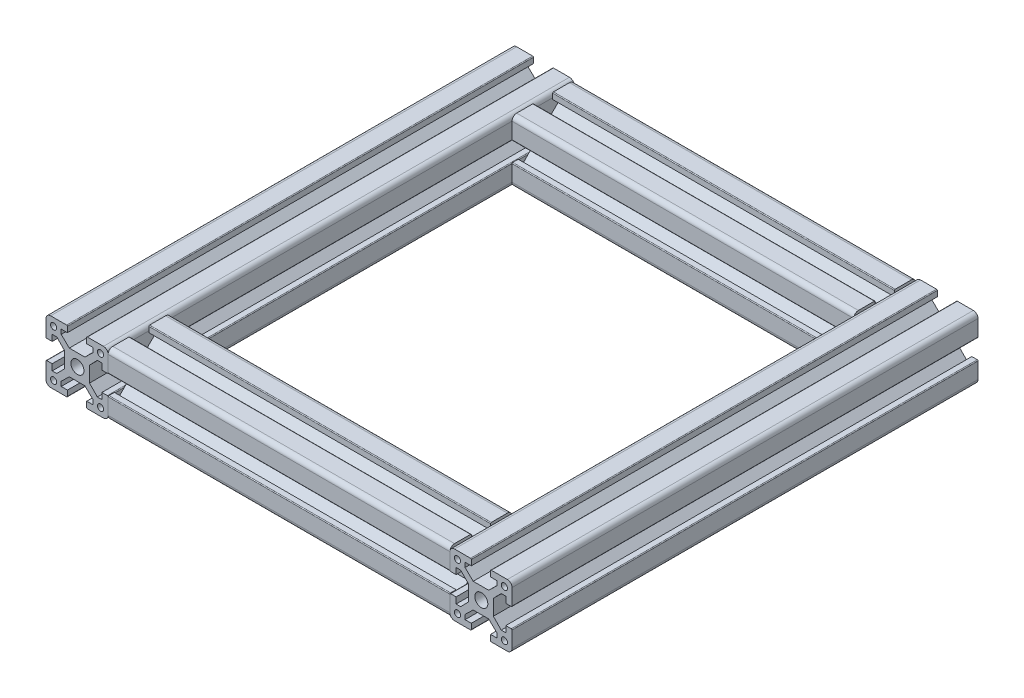
from build123d import *

# Parameters (mm, degrees)
XA_XA_2020T_1_DEPTH      = 140.110875788
XA_XA_2020T_1_DEPTH_BACK = 9.889124212
SKETCH1_R                = 1
SKETCH1_R_2              = 2.1
SKETCH1_ON_SEGMENT_2_R   = 1
SKETCH1_ON_SEGMENT_2_R_2 = 2.1
XA_XA_2020T_1_2_DEPTH    = 150
SKETCH1_ON_SEGMENT_3_R   = 1
SKETCH1_ON_SEGMENT_3_R_2 = 2.1
XA_XA_2020T_1_3_DEPTH    = 132
SKETCH1_ON_SEGMENT_4_R   = 1
SKETCH1_ON_SEGMENT_4_R_2 = 2.1
XA_XA_2020T_1_4_DEPTH    = 132


with BuildPart() as part:
    # Sketch1 → Xa XA-2020T(1) (new, two sides: drawn at the far end of the back side and taken through both)
    with BuildSketch(Plane(origin=(-65, 0, 65), x_dir=(-1, 0, 0), z_dir=(0, 0, -1)).offset(-XA_XA_2020T_1_DEPTH_BACK)):
        with BuildLine():
            Line((-9.889124212, 8.439448346), (-9.889124212, 3.289448346))
            ThreePointArc((-9.889124212, 3.289448346), (-9.815900907, 3.112671651), (-9.639124212, 3.039448346))
            Line((-9.639124212, 3.039448346), (-7.889124212, 3.039448346))
            Line((-7.889124212, 3.039448346), (-7.889124212, 5.039448346))
            Line((-7.889124212, 5.039448346), (-6.41690199, 5.039448346))
            Line((-6.41690199, 5.039448346), (-3.889124212, 2.439448346))
            Line((-3.889124212, 2.439448346), (-3.889124212, -2.560551654))
            Line((-3.889124212, -2.560551654), (-6.41690199, -5.160551654))
            Line((-6.41690199, -5.160551654), (-7.889124212, -5.160551654))
            Line((-7.889124212, -5.160551654), (-7.889124212, -3.160551654))
            Line((-7.889124212, -3.160551654), (-9.639124212, -3.160551654))
            ThreePointArc((-9.639124212, -3.160551654), (-9.815900907, -3.233774958), (-9.889124212, -3.410551654))
            Line((-9.889124212, -3.410551654), (-9.889124212, -8.560551654))
            ThreePointArc((-9.889124212, -8.560551654), (-9.449784384, -9.621211825), (-8.389124212, -10.060551654))
            Line((-8.389124212, -10.060551654), (-3.239124212, -10.060551654))
            ThreePointArc((-3.239124212, -10.060551654), (-3.062347516, -9.987328349), (-2.989124212, -9.810551654))
            Line((-2.989124212, -9.810551654), (-2.989124212, -8.060551654))
            Line((-2.989124212, -8.060551654), (-4.989124212, -8.060551654))
            Line((-4.989124212, -8.060551654), (-4.989124212, -6.588329431))
            Line((-4.989124212, -6.588329431), (-2.389124212, -4.060551654))
            Line((-2.389124212, -4.060551654), (2.610875788, -4.060551654))
            Line((2.610875788, -4.060551654), (5.210875788, -6.588329431))
            Line((5.210875788, -6.588329431), (5.210875788, -8.060551654))
            Line((5.210875788, -8.060551654), (3.210875788, -8.060551654))
            Line((3.210875788, -8.060551654), (3.210875788, -9.810551654))
            ThreePointArc((3.210875788, -9.810551654), (3.284099093, -9.987328349), (3.460875788, -10.060551654))
            Line((3.460875788, -10.060551654), (8.610875788, -10.060551654))
            ThreePointArc((8.610875788, -10.060551654), (9.67153596, -9.621211825), (10.110875788, -8.560551654))
            Line((10.110875788, -8.560551654), (10.110875788, -3.410551654))
            ThreePointArc((10.110875788, -3.410551654), (10.037652484, -3.233774958), (9.860875788, -3.160551654))
            Line((9.860875788, -3.160551654), (8.110875788, -3.160551654))
            Line((8.110875788, -3.160551654), (8.110875788, -5.160551654))
            Line((8.110875788, -5.160551654), (6.638653566, -5.160551654))
            Line((6.638653566, -5.160551654), (4.110875788, -2.560551654))
            Line((4.110875788, -2.560551654), (4.110875788, 2.439448346))
            Line((4.110875788, 2.439448346), (6.638653566, 5.039448346))
            Line((6.638653566, 5.039448346), (8.110875788, 5.039448346))
            Line((8.110875788, 5.039448346), (8.110875788, 3.039448346))
            Line((8.110875788, 3.039448346), (9.860875788, 3.039448346))
            ThreePointArc((9.860875788, 3.039448346), (10.037652484, 3.112671651), (10.110875788, 3.289448346))
            Line((10.110875788, 3.289448346), (10.110875788, 8.439448346))
            ThreePointArc((10.110875788, 8.439448346), (9.67153596, 9.500108518), (8.610875788, 9.939448346))
            Line((8.610875788, 9.939448346), (3.460875788, 9.939448346))
            ThreePointArc((3.460875788, 9.939448346), (3.284099093, 9.866225042), (3.210875788, 9.689448346))
            Line((3.210875788, 9.689448346), (3.210875788, 7.939448346))
            Line((3.210875788, 7.939448346), (5.210875788, 7.939448346))
            Line((5.210875788, 7.939448346), (5.210875788, 6.467226124))
            Line((5.210875788, 6.467226124), (2.610875788, 3.939448346))
            Line((2.610875788, 3.939448346), (-2.389124212, 3.939448346))
            Line((-2.389124212, 3.939448346), (-4.989124212, 6.467226124))
            Line((-4.989124212, 6.467226124), (-4.989124212, 7.939448346))
            Line((-4.989124212, 7.939448346), (-2.989124212, 7.939448346))
            Line((-2.989124212, 7.939448346), (-2.989124212, 9.689448346))
            ThreePointArc((-2.989124212, 9.689448346), (-3.062347516, 9.866225042), (-3.239124212, 9.939448346))
            Line((-3.239124212, 9.939448346), (-8.389124212, 9.939448346))
            ThreePointArc((-8.389124212, 9.939448346), (-9.449784384, 9.500108518), (-9.889124212, 8.439448346))
        make_face()
        with Locations((-7.439124212, 7.489448346)):
            Circle(SKETCH1_R, mode=Mode.SUBTRACT)
        with Locations((7.660875788, 7.489448346)):
            Circle(SKETCH1_R, mode=Mode.SUBTRACT)
        with Locations((-7.439124212, -7.610551654)):
            Circle(SKETCH1_R, mode=Mode.SUBTRACT)
        with Locations((7.660875788, -7.610551654)):
            Circle(SKETCH1_R, mode=Mode.SUBTRACT)
        Circle(SKETCH1_R_2, mode=Mode.SUBTRACT)
    extrude(amount=XA_XA_2020T_1_DEPTH + XA_XA_2020T_1_DEPTH_BACK)


with BuildPart() as body_2:
    # Sketch1 on segment 2 (carried to segment 2) → Xa XA-2020T_1 2 (new body)
    with BuildSketch(Plane(origin=(65, 0, 74.889124212), x_dir=(-1, 0, 0), z_dir=(0, 0, -1))):
        with BuildLine():
            Line((-9.889124212, 8.439448346), (-9.889124212, 3.289448346))
            ThreePointArc((-9.889124212, 3.289448346), (-9.815900907, 3.112671651), (-9.639124212, 3.039448346))
            Line((-9.639124212, 3.039448346), (-7.889124212, 3.039448346))
            Line((-7.889124212, 3.039448346), (-7.889124212, 5.039448346))
            Line((-7.889124212, 5.039448346), (-6.41690199, 5.039448346))
            Line((-6.41690199, 5.039448346), (-3.889124212, 2.439448346))
            Line((-3.889124212, 2.439448346), (-3.889124212, -2.560551654))
            Line((-3.889124212, -2.560551654), (-6.41690199, -5.160551654))
            Line((-6.41690199, -5.160551654), (-7.889124212, -5.160551654))
            Line((-7.889124212, -5.160551654), (-7.889124212, -3.160551654))
            Line((-7.889124212, -3.160551654), (-9.639124212, -3.160551654))
            ThreePointArc((-9.639124212, -3.160551654), (-9.815900907, -3.233774958), (-9.889124212, -3.410551654))
            Line((-9.889124212, -3.410551654), (-9.889124212, -8.560551654))
            ThreePointArc((-9.889124212, -8.560551654), (-9.449784384, -9.621211825), (-8.389124212, -10.060551654))
            Line((-8.389124212, -10.060551654), (-3.239124212, -10.060551654))
            ThreePointArc((-3.239124212, -10.060551654), (-3.062347516, -9.987328349), (-2.989124212, -9.810551654))
            Line((-2.989124212, -9.810551654), (-2.989124212, -8.060551654))
            Line((-2.989124212, -8.060551654), (-4.989124212, -8.060551654))
            Line((-4.989124212, -8.060551654), (-4.989124212, -6.588329431))
            Line((-4.989124212, -6.588329431), (-2.389124212, -4.060551654))
            Line((-2.389124212, -4.060551654), (2.610875788, -4.060551654))
            Line((2.610875788, -4.060551654), (5.210875788, -6.588329431))
            Line((5.210875788, -6.588329431), (5.210875788, -8.060551654))
            Line((5.210875788, -8.060551654), (3.210875788, -8.060551654))
            Line((3.210875788, -8.060551654), (3.210875788, -9.810551654))
            ThreePointArc((3.210875788, -9.810551654), (3.284099093, -9.987328349), (3.460875788, -10.060551654))
            Line((3.460875788, -10.060551654), (8.610875788, -10.060551654))
            ThreePointArc((8.610875788, -10.060551654), (9.67153596, -9.621211825), (10.110875788, -8.560551654))
            Line((10.110875788, -8.560551654), (10.110875788, -3.410551654))
            ThreePointArc((10.110875788, -3.410551654), (10.037652484, -3.233774958), (9.860875788, -3.160551654))
            Line((9.860875788, -3.160551654), (8.110875788, -3.160551654))
            Line((8.110875788, -3.160551654), (8.110875788, -5.160551654))
            Line((8.110875788, -5.160551654), (6.638653566, -5.160551654))
            Line((6.638653566, -5.160551654), (4.110875788, -2.560551654))
            Line((4.110875788, -2.560551654), (4.110875788, 2.439448346))
            Line((4.110875788, 2.439448346), (6.638653566, 5.039448346))
            Line((6.638653566, 5.039448346), (8.110875788, 5.039448346))
            Line((8.110875788, 5.039448346), (8.110875788, 3.039448346))
            Line((8.110875788, 3.039448346), (9.860875788, 3.039448346))
            ThreePointArc((9.860875788, 3.039448346), (10.037652484, 3.112671651), (10.110875788, 3.289448346))
            Line((10.110875788, 3.289448346), (10.110875788, 8.439448346))
            ThreePointArc((10.110875788, 8.439448346), (9.67153596, 9.500108518), (8.610875788, 9.939448346))
            Line((8.610875788, 9.939448346), (3.460875788, 9.939448346))
            ThreePointArc((3.460875788, 9.939448346), (3.284099093, 9.866225042), (3.210875788, 9.689448346))
            Line((3.210875788, 9.689448346), (3.210875788, 7.939448346))
            Line((3.210875788, 7.939448346), (5.210875788, 7.939448346))
            Line((5.210875788, 7.939448346), (5.210875788, 6.467226124))
            Line((5.210875788, 6.467226124), (2.610875788, 3.939448346))
            Line((2.610875788, 3.939448346), (-2.389124212, 3.939448346))
            Line((-2.389124212, 3.939448346), (-4.989124212, 6.467226124))
            Line((-4.989124212, 6.467226124), (-4.989124212, 7.939448346))
            Line((-4.989124212, 7.939448346), (-2.989124212, 7.939448346))
            Line((-2.989124212, 7.939448346), (-2.989124212, 9.689448346))
            ThreePointArc((-2.989124212, 9.689448346), (-3.062347516, 9.866225042), (-3.239124212, 9.939448346))
            Line((-3.239124212, 9.939448346), (-8.389124212, 9.939448346))
            ThreePointArc((-8.389124212, 9.939448346), (-9.449784384, 9.500108518), (-9.889124212, 8.439448346))
        make_face()
        with Locations((-7.439124212, 7.489448346)):
            Circle(SKETCH1_ON_SEGMENT_2_R, mode=Mode.SUBTRACT)
        with Locations((7.660875788, 7.489448346)):
            Circle(SKETCH1_ON_SEGMENT_2_R, mode=Mode.SUBTRACT)
        with Locations((-7.439124212, -7.610551654)):
            Circle(SKETCH1_ON_SEGMENT_2_R, mode=Mode.SUBTRACT)
        with Locations((7.660875788, -7.610551654)):
            Circle(SKETCH1_ON_SEGMENT_2_R, mode=Mode.SUBTRACT)
        Circle(SKETCH1_ON_SEGMENT_2_R_2, mode=Mode.SUBTRACT)
    extrude(amount=XA_XA_2020T_1_2_DEPTH)


with BuildPart() as body_3:
    # Sketch1 on segment 3 (carried to segment 3) → Xa XA-2020T_1 3 (new body)
    with BuildSketch(Plane(origin=(-66, 0, 65), x_dir=(0, 0, -1), z_dir=(1, 0, 0))):
        with BuildLine():
            Line((-9.889124212, 8.439448346), (-9.889124212, 3.289448346))
            ThreePointArc((-9.889124212, 3.289448346), (-9.815900907, 3.112671651), (-9.639124212, 3.039448346))
            Line((-9.639124212, 3.039448346), (-7.889124212, 3.039448346))
            Line((-7.889124212, 3.039448346), (-7.889124212, 5.039448346))
            Line((-7.889124212, 5.039448346), (-6.41690199, 5.039448346))
            Line((-6.41690199, 5.039448346), (-3.889124212, 2.439448346))
            Line((-3.889124212, 2.439448346), (-3.889124212, -2.560551654))
            Line((-3.889124212, -2.560551654), (-6.41690199, -5.160551654))
            Line((-6.41690199, -5.160551654), (-7.889124212, -5.160551654))
            Line((-7.889124212, -5.160551654), (-7.889124212, -3.160551654))
            Line((-7.889124212, -3.160551654), (-9.639124212, -3.160551654))
            ThreePointArc((-9.639124212, -3.160551654), (-9.815900907, -3.233774958), (-9.889124212, -3.410551654))
            Line((-9.889124212, -3.410551654), (-9.889124212, -8.560551654))
            ThreePointArc((-9.889124212, -8.560551654), (-9.449784384, -9.621211825), (-8.389124212, -10.060551654))
            Line((-8.389124212, -10.060551654), (-3.239124212, -10.060551654))
            ThreePointArc((-3.239124212, -10.060551654), (-3.062347516, -9.987328349), (-2.989124212, -9.810551654))
            Line((-2.989124212, -9.810551654), (-2.989124212, -8.060551654))
            Line((-2.989124212, -8.060551654), (-4.989124212, -8.060551654))
            Line((-4.989124212, -8.060551654), (-4.989124212, -6.588329431))
            Line((-4.989124212, -6.588329431), (-2.389124212, -4.060551654))
            Line((-2.389124212, -4.060551654), (2.610875788, -4.060551654))
            Line((2.610875788, -4.060551654), (5.210875788, -6.588329431))
            Line((5.210875788, -6.588329431), (5.210875788, -8.060551654))
            Line((5.210875788, -8.060551654), (3.210875788, -8.060551654))
            Line((3.210875788, -8.060551654), (3.210875788, -9.810551654))
            ThreePointArc((3.210875788, -9.810551654), (3.284099093, -9.987328349), (3.460875788, -10.060551654))
            Line((3.460875788, -10.060551654), (8.610875788, -10.060551654))
            ThreePointArc((8.610875788, -10.060551654), (9.67153596, -9.621211825), (10.110875788, -8.560551654))
            Line((10.110875788, -8.560551654), (10.110875788, -3.410551654))
            ThreePointArc((10.110875788, -3.410551654), (10.037652484, -3.233774958), (9.860875788, -3.160551654))
            Line((9.860875788, -3.160551654), (8.110875788, -3.160551654))
            Line((8.110875788, -3.160551654), (8.110875788, -5.160551654))
            Line((8.110875788, -5.160551654), (6.638653566, -5.160551654))
            Line((6.638653566, -5.160551654), (4.110875788, -2.560551654))
            Line((4.110875788, -2.560551654), (4.110875788, 2.439448346))
            Line((4.110875788, 2.439448346), (6.638653566, 5.039448346))
            Line((6.638653566, 5.039448346), (8.110875788, 5.039448346))
            Line((8.110875788, 5.039448346), (8.110875788, 3.039448346))
            Line((8.110875788, 3.039448346), (9.860875788, 3.039448346))
            ThreePointArc((9.860875788, 3.039448346), (10.037652484, 3.112671651), (10.110875788, 3.289448346))
            Line((10.110875788, 3.289448346), (10.110875788, 8.439448346))
            ThreePointArc((10.110875788, 8.439448346), (9.67153596, 9.500108518), (8.610875788, 9.939448346))
            Line((8.610875788, 9.939448346), (3.460875788, 9.939448346))
            ThreePointArc((3.460875788, 9.939448346), (3.284099093, 9.866225042), (3.210875788, 9.689448346))
            Line((3.210875788, 9.689448346), (3.210875788, 7.939448346))
            Line((3.210875788, 7.939448346), (5.210875788, 7.939448346))
            Line((5.210875788, 7.939448346), (5.210875788, 6.467226124))
            Line((5.210875788, 6.467226124), (2.610875788, 3.939448346))
            Line((2.610875788, 3.939448346), (-2.389124212, 3.939448346))
            Line((-2.389124212, 3.939448346), (-4.989124212, 6.467226124))
            Line((-4.989124212, 6.467226124), (-4.989124212, 7.939448346))
            Line((-4.989124212, 7.939448346), (-2.989124212, 7.939448346))
            Line((-2.989124212, 7.939448346), (-2.989124212, 9.689448346))
            ThreePointArc((-2.989124212, 9.689448346), (-3.062347516, 9.866225042), (-3.239124212, 9.939448346))
            Line((-3.239124212, 9.939448346), (-8.389124212, 9.939448346))
            ThreePointArc((-8.389124212, 9.939448346), (-9.449784384, 9.500108518), (-9.889124212, 8.439448346))
        make_face()
        with Locations((-7.439124212, 7.489448346)):
            Circle(SKETCH1_ON_SEGMENT_3_R, mode=Mode.SUBTRACT)
        with Locations((7.660875788, 7.489448346)):
            Circle(SKETCH1_ON_SEGMENT_3_R, mode=Mode.SUBTRACT)
        with Locations((-7.439124212, -7.610551654)):
            Circle(SKETCH1_ON_SEGMENT_3_R, mode=Mode.SUBTRACT)
        with Locations((7.660875788, -7.610551654)):
            Circle(SKETCH1_ON_SEGMENT_3_R, mode=Mode.SUBTRACT)
        Circle(SKETCH1_ON_SEGMENT_3_R_2, mode=Mode.SUBTRACT)
    extrude(amount=XA_XA_2020T_1_3_DEPTH)

    # Xa XA-2020T_1 3 end butt 1
    split(bisect_by=Plane(origin=(-55.110875788, 0, 65), x_dir=(0, 1, 0), z_dir=(1, 0, 0)), keep=Keep.TOP)

    # Xa XA-2020T_1 3 end butt 2
    split(bisect_by=Plane(origin=(54.889124212, 0, 65), x_dir=(0, -1, 0), z_dir=(-1, 0, 0)), keep=Keep.TOP)


with BuildPart() as body_4:
    # Sketch1 on segment 4 (carried to segment 4) → Xa XA-2020T_1 4 (new body)
    with BuildSketch(Plane(origin=(-66, 0, -65), x_dir=(0, 0, -1), z_dir=(1, 0, 0))):
        with BuildLine():
            Line((-9.889124212, 8.439448346), (-9.889124212, 3.289448346))
            ThreePointArc((-9.889124212, 3.289448346), (-9.815900907, 3.112671651), (-9.639124212, 3.039448346))
            Line((-9.639124212, 3.039448346), (-7.889124212, 3.039448346))
            Line((-7.889124212, 3.039448346), (-7.889124212, 5.039448346))
            Line((-7.889124212, 5.039448346), (-6.41690199, 5.039448346))
            Line((-6.41690199, 5.039448346), (-3.889124212, 2.439448346))
            Line((-3.889124212, 2.439448346), (-3.889124212, -2.560551654))
            Line((-3.889124212, -2.560551654), (-6.41690199, -5.160551654))
            Line((-6.41690199, -5.160551654), (-7.889124212, -5.160551654))
            Line((-7.889124212, -5.160551654), (-7.889124212, -3.160551654))
            Line((-7.889124212, -3.160551654), (-9.639124212, -3.160551654))
            ThreePointArc((-9.639124212, -3.160551654), (-9.815900907, -3.233774958), (-9.889124212, -3.410551654))
            Line((-9.889124212, -3.410551654), (-9.889124212, -8.560551654))
            ThreePointArc((-9.889124212, -8.560551654), (-9.449784384, -9.621211825), (-8.389124212, -10.060551654))
            Line((-8.389124212, -10.060551654), (-3.239124212, -10.060551654))
            ThreePointArc((-3.239124212, -10.060551654), (-3.062347516, -9.987328349), (-2.989124212, -9.810551654))
            Line((-2.989124212, -9.810551654), (-2.989124212, -8.060551654))
            Line((-2.989124212, -8.060551654), (-4.989124212, -8.060551654))
            Line((-4.989124212, -8.060551654), (-4.989124212, -6.588329431))
            Line((-4.989124212, -6.588329431), (-2.389124212, -4.060551654))
            Line((-2.389124212, -4.060551654), (2.610875788, -4.060551654))
            Line((2.610875788, -4.060551654), (5.210875788, -6.588329431))
            Line((5.210875788, -6.588329431), (5.210875788, -8.060551654))
            Line((5.210875788, -8.060551654), (3.210875788, -8.060551654))
            Line((3.210875788, -8.060551654), (3.210875788, -9.810551654))
            ThreePointArc((3.210875788, -9.810551654), (3.284099093, -9.987328349), (3.460875788, -10.060551654))
            Line((3.460875788, -10.060551654), (8.610875788, -10.060551654))
            ThreePointArc((8.610875788, -10.060551654), (9.67153596, -9.621211825), (10.110875788, -8.560551654))
            Line((10.110875788, -8.560551654), (10.110875788, -3.410551654))
            ThreePointArc((10.110875788, -3.410551654), (10.037652484, -3.233774958), (9.860875788, -3.160551654))
            Line((9.860875788, -3.160551654), (8.110875788, -3.160551654))
            Line((8.110875788, -3.160551654), (8.110875788, -5.160551654))
            Line((8.110875788, -5.160551654), (6.638653566, -5.160551654))
            Line((6.638653566, -5.160551654), (4.110875788, -2.560551654))
            Line((4.110875788, -2.560551654), (4.110875788, 2.439448346))
            Line((4.110875788, 2.439448346), (6.638653566, 5.039448346))
            Line((6.638653566, 5.039448346), (8.110875788, 5.039448346))
            Line((8.110875788, 5.039448346), (8.110875788, 3.039448346))
            Line((8.110875788, 3.039448346), (9.860875788, 3.039448346))
            ThreePointArc((9.860875788, 3.039448346), (10.037652484, 3.112671651), (10.110875788, 3.289448346))
            Line((10.110875788, 3.289448346), (10.110875788, 8.439448346))
            ThreePointArc((10.110875788, 8.439448346), (9.67153596, 9.500108518), (8.610875788, 9.939448346))
            Line((8.610875788, 9.939448346), (3.460875788, 9.939448346))
            ThreePointArc((3.460875788, 9.939448346), (3.284099093, 9.866225042), (3.210875788, 9.689448346))
            Line((3.210875788, 9.689448346), (3.210875788, 7.939448346))
            Line((3.210875788, 7.939448346), (5.210875788, 7.939448346))
            Line((5.210875788, 7.939448346), (5.210875788, 6.467226124))
            Line((5.210875788, 6.467226124), (2.610875788, 3.939448346))
            Line((2.610875788, 3.939448346), (-2.389124212, 3.939448346))
            Line((-2.389124212, 3.939448346), (-4.989124212, 6.467226124))
            Line((-4.989124212, 6.467226124), (-4.989124212, 7.939448346))
            Line((-4.989124212, 7.939448346), (-2.989124212, 7.939448346))
            Line((-2.989124212, 7.939448346), (-2.989124212, 9.689448346))
            ThreePointArc((-2.989124212, 9.689448346), (-3.062347516, 9.866225042), (-3.239124212, 9.939448346))
            Line((-3.239124212, 9.939448346), (-8.389124212, 9.939448346))
            ThreePointArc((-8.389124212, 9.939448346), (-9.449784384, 9.500108518), (-9.889124212, 8.439448346))
        make_face()
        with Locations((-7.439124212, 7.489448346)):
            Circle(SKETCH1_ON_SEGMENT_4_R, mode=Mode.SUBTRACT)
        with Locations((7.660875788, 7.489448346)):
            Circle(SKETCH1_ON_SEGMENT_4_R, mode=Mode.SUBTRACT)
        with Locations((-7.439124212, -7.610551654)):
            Circle(SKETCH1_ON_SEGMENT_4_R, mode=Mode.SUBTRACT)
        with Locations((7.660875788, -7.610551654)):
            Circle(SKETCH1_ON_SEGMENT_4_R, mode=Mode.SUBTRACT)
        Circle(SKETCH1_ON_SEGMENT_4_R_2, mode=Mode.SUBTRACT)
    extrude(amount=XA_XA_2020T_1_4_DEPTH)

    # Xa XA-2020T_1 4 end butt 1
    split(bisect_by=Plane(origin=(-55.110875788, 0, -65), x_dir=(0, 1, 0), z_dir=(1, 0, 0)), keep=Keep.TOP)

    # Xa XA-2020T_1 4 end butt 2
    split(bisect_by=Plane(origin=(54.889124212, 0, -65), x_dir=(0, -1, 0), z_dir=(-1, 0, 0)), keep=Keep.TOP)


solid = Compound([part.part, body_2.part, body_3.part, body_4.part])
